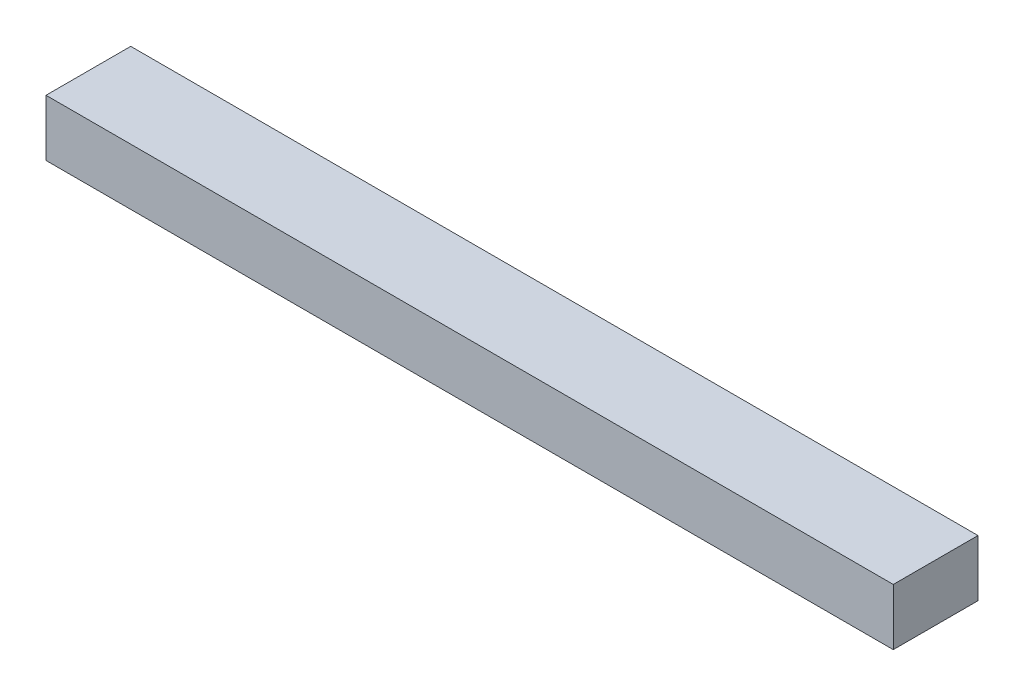
from build123d import *

# Parameters (mm, degrees)
SKETCH1_W           = 190.5
SKETCH1_H           = 19.05
BOSS_EXTRUDE1_DEPTH = 12.7


with BuildPart() as part:
    # Sketch1 → Boss-Extrude1 (new body)
    with BuildSketch(Plane(origin=(0, 0, 0), x_dir=(1, 0, 0), z_dir=(0, 1, 0))):
        with Locations((95.25, 9.525)):
            Rectangle(SKETCH1_W, SKETCH1_H)
    extrude(amount=BOSS_EXTRUDE1_DEPTH)


solid = part.part
